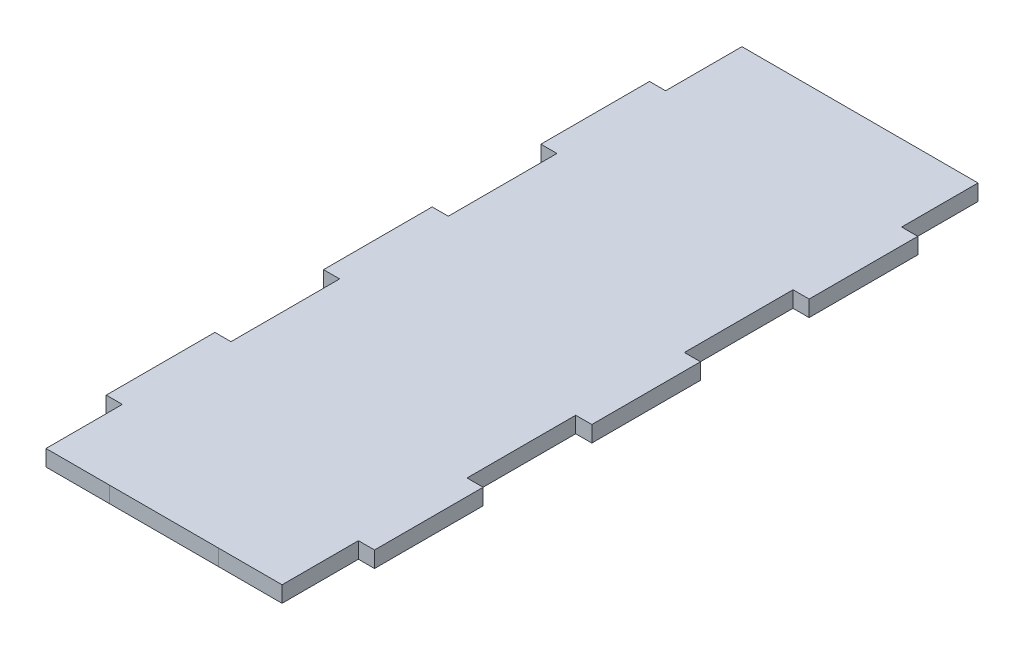
from build123d import *

# Parameters (mm, degrees)
SKETCH1_W               = 517.884603554
SKETCH1_H               = 307.545036654
BOSS_EXTRUDE1_DEPTH     = 6
CUT_EXTRUDE_THIN1_DEPTH = 302.219360338


with BuildPart() as part:
    # Sketch1 → Boss-Extrude1 (new body)
    with BuildSketch(Plane(origin=(0, 0, 0), x_dir=(1, 0, 0), z_dir=(0, 1, 0))):
        Rectangle(SKETCH1_W, SKETCH1_H)
    extrude(amount=BOSS_EXTRUDE1_DEPTH)

    # Sketch2 → Cut-Extrude-Thin1 (cut, through all)
    with BuildSketch(Plane(origin=(0, 6, 0), x_dir=(1, 0, 0), z_dir=(0, 1, 0))):
        Polygon((38.897086644, -123.820706525), (38.897086644, -95.364474608), (44.897086809, -95.364474608), (44.897086809, -54.854473491), (38.897086644, -54.854473491), (38.897086644, -14.364472375), (44.897086809, -14.364472375), (44.897086809, 26.145528742), (38.897086644, 26.145528742), (38.897086644, 66.635529858), (44.897086809, 66.635529858), (44.897086809, 107.145530974), (38.897086644, 107.145530974), (38.897086644, 135.602227437), (15.137085989, 135.602227437), (15.137085989, 135.600548849), (-25.352915127, 135.600548849), (-25.352915127, 135.602227437), (-49.112915782, 135.602227437), (-49.112915782, 107.145530974), (-55.112946465, 107.145530974), (-55.112946465, 66.635529858), (-49.112915782, 66.635529858), (-49.112915782, 26.145528742), (-55.112946465, 26.145528742), (-55.112946465, -14.364472375), (-49.112915782, -14.364472375), (-49.112915782, -54.854473491), (-55.112946465, -54.854473491), (-55.112946465, -95.364474608), (-49.112915782, -95.364474608), (-49.112915782, -123.820706525), (-25.352915127, -123.820706525), (-25.352915127, -123.819461964), (15.137085989, -123.819461964), (15.137085989, -123.820706525), align=None)
        Polygon((38.887086644, -123.810706525), (38.887086644, -95.354474608), (44.887086809, -95.354474608), (44.887086809, -54.864473491), (38.887086644, -54.864473491), (38.887086644, -14.354472375), (44.887086809, -14.354472375), (44.887086809, 26.135528742), (38.887086644, 26.135528742), (38.887086644, 66.645529858), (44.887086809, 66.645529858), (44.887086809, 107.135530974), (38.887086644, 107.135530974), (38.887086644, 135.592227437), (15.147085989, 135.592227437), (15.147085989, 135.590548849), (-25.362915127, 135.590548849), (-25.362915127, 135.592227437), (-49.102915782, 135.592227437), (-49.102915782, 107.135530974), (-55.102946465, 107.135530974), (-55.102946465, 66.645529858), (-49.102915782, 66.645529858), (-49.102915782, 26.135528742), (-55.102946465, 26.135528742), (-55.102946465, -14.354472375), (-49.102915782, -14.354472375), (-49.102915782, -54.864473491), (-55.102946465, -54.864473491), (-55.102946465, -95.354474608), (-49.102915782, -95.354474608), (-49.102915782, -123.810706525), (-25.362915127, -123.810706525), (-25.362915127, -123.809461964), (15.147085989, -123.809461964), (15.147085989, -123.810706525), align=None, mode=Mode.SUBTRACT)
    extrude(amount=-CUT_EXTRUDE_THIN1_DEPTH, mode=Mode.SUBTRACT)


with BuildPart() as body_2:
    # of the pieces the cut leaves, the one that is kept (cut_extrude_thin1_keep)
    add(part.part.solids().sort_by_distance((15.147085989, 0, 123.809461964))[0])


solid = body_2.part
